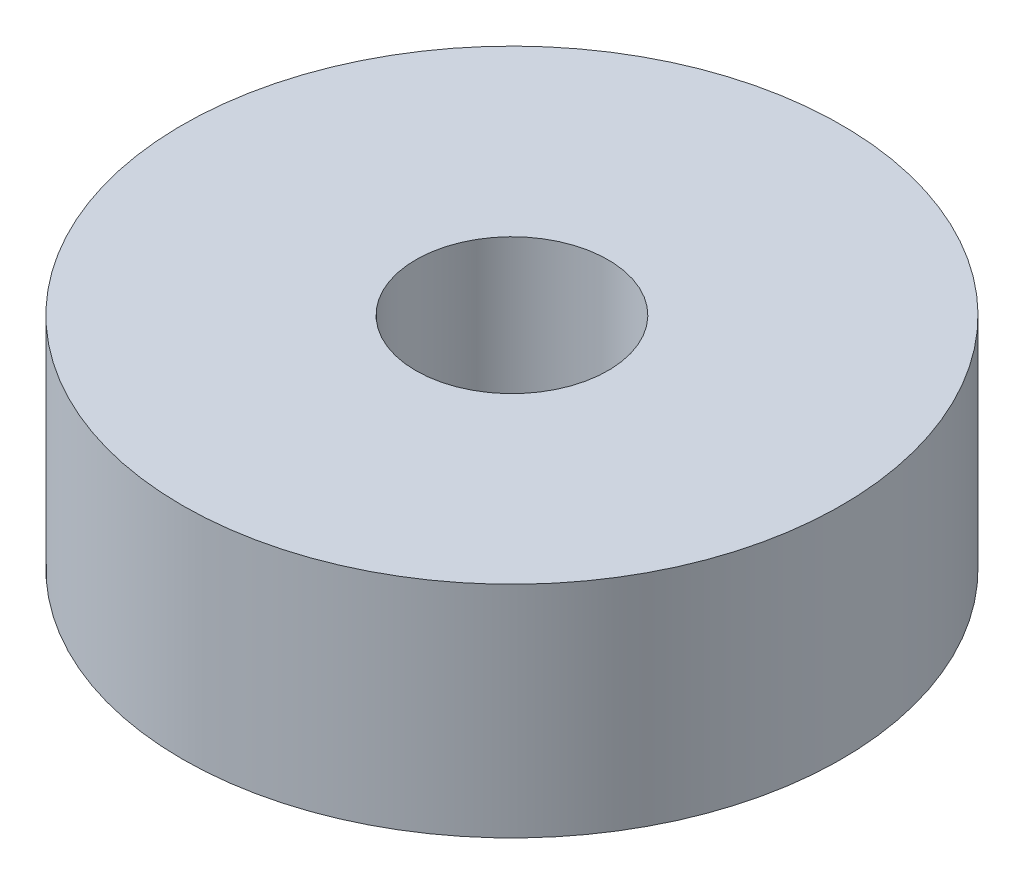
from build123d import *

# Parameters (mm, degrees)
SKETCH1_R           = 6
SKETCH1_R_2         = 1.75
BOSS_EXTRUDE1_DEPTH = 4


with BuildPart() as part:
    # Sketch1 → Boss-Extrude1 (new body)
    with BuildSketch(Plane(origin=(0, 0, 0), x_dir=(1, 0, 0), z_dir=(0, 1, 0))):
        with Locations(Location((0, 0, 0), (0, 0, 270))):
            Circle(SKETCH1_R)
        with Locations(Location((0, 0, 0), (0, 0, 270))):
            Circle(SKETCH1_R_2, mode=Mode.SUBTRACT)
    extrude(amount=BOSS_EXTRUDE1_DEPTH)


solid = part.part
